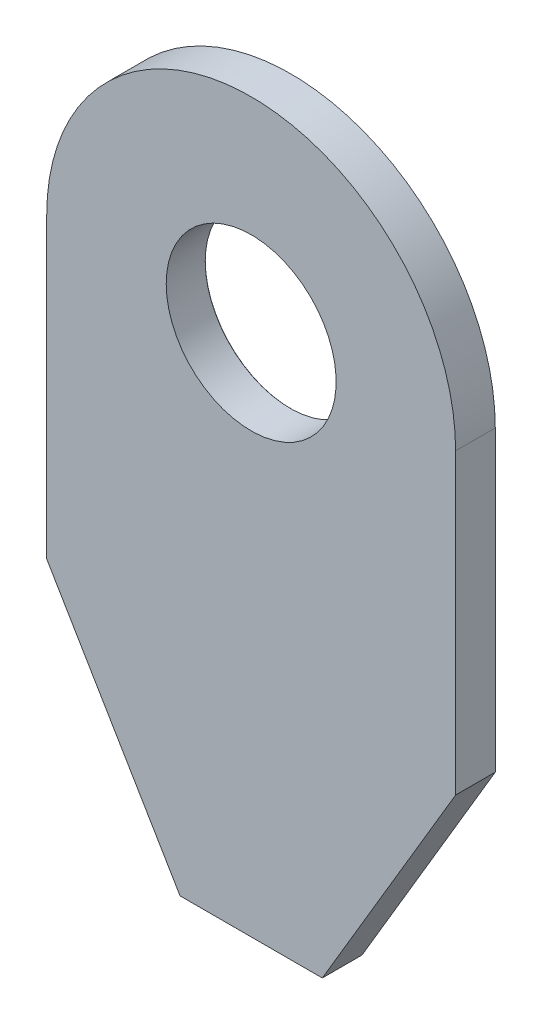
from build123d import *

# Parameters (mm, degrees)
BOSS_EXTRUDE1_DEPTH = 1.54


with BuildPart() as part:
    # Sketch1 → Boss-Extrude1 (new body)
    with BuildSketch(Plane.XY):
        with BuildLine():
            Line((7.939999995, -11.57844725), (7.939999995, 0))
            ThreePointArc((7.939999995, 0), (0, 7.939999995), (-7.939999995, 0))
            Line((-7.939999995, 0), (-7.939999995, -11.57844725))
            Line((-7.939999995, -11.57844725), (-2.762079996, -20.32))
            Line((-2.762079996, -20.32), (2.762079996, -20.32))
            Line((2.762079996, -20.32), (7.939999995, -11.57844725))
        make_face()
    extrude(amount=BOSS_EXTRUDE1_DEPTH)

    # Sketch3 → M6 Clearance Hole1 (revolve, cut)
    with BuildSketch(Plane.YZ):
        Polygon((0, 0), (0, 1.54), (3.3, 1.54), (3.3, 0.025), (3.325, 0), align=None)
    revolve(axis=Axis((0, 0, -6.35), (0, 0, 1)), mode=Mode.SUBTRACT)


solid = part.part
